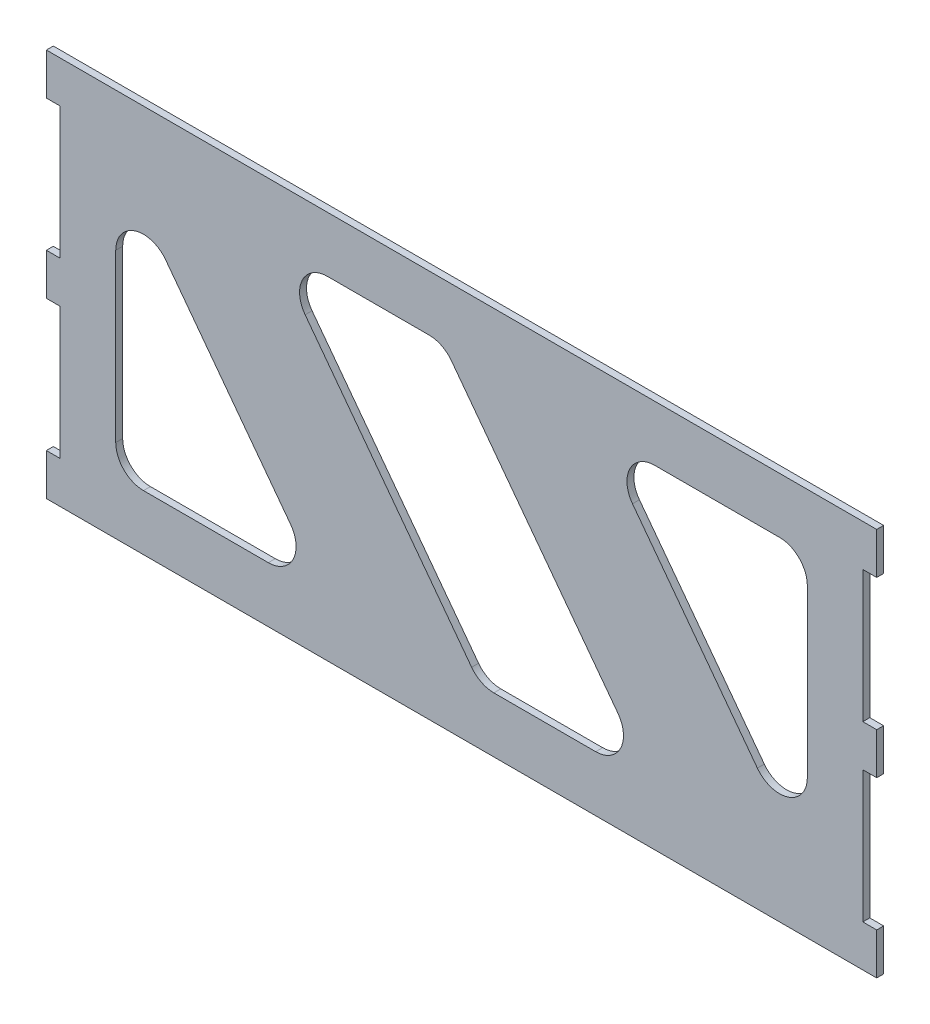
from build123d import *

# Parameters (mm, degrees)
SKETCH1_W           = 183.656
SKETCH1_H           = 88.9
BOSS_EXTRUDE1_DEPTH = 1.5875
CUT_EXTRUDE1_DEPTH  = 1.5875
FILLET1_R           = 6.35
SKETCH3_W           = 1.5875
SKETCH3_H           = 9.525
BOSS_EXTRUDE2_DEPTH = 3.175


with BuildPart() as part:
    # Sketch1 → Boss-Extrude1 (new body)
    with BuildSketch(Plane.XY):
        with Locations((3.944, 974.412014871)):
            Rectangle(SKETCH1_W, SKETCH1_H)
    extrude(amount=BOSS_EXTRUDE1_DEPTH)

    # Sketch2 → Cut-Extrude1 (cut)
    with BuildSketch(Plane.XY.offset(1.5875)):
        with BuildLine():
            Line((-63.754, 990.922014871), (-35.179, 952.822014871))
            ThreePointArc((-35.179, 952.822014871), (-34.579387337, 946.172208539), (-40.259, 942.662014871))
            Line((-40.259, 942.662014871), (-68.834, 942.662014871))
            ThreePointArc((-68.834, 942.662014871), (-73.324128061, 944.52188681), (-75.184, 949.012014871))
            Line((-75.184, 949.012014871), (-75.184, 987.112014871))
            ThreePointArc((-75.184, 987.112014871), (-70.842046314, 993.136153813), (-63.754, 990.922014871))
        make_face()
        with BuildLine():
            Line((71.642, 957.902014871), (43.067, 996.002014871))
            ThreePointArc((43.067, 996.002014871), (42.467387337, 1002.651821202), (48.147, 1006.162014871))
            Line((48.147, 1006.162014871), (76.722, 1006.162014871))
            ThreePointArc((76.722, 1006.162014871), (81.212128061, 1004.302142931), (83.072, 999.812014871))
            Line((83.072, 999.812014871), (83.072, 961.712014871))
            ThreePointArc((83.072, 961.712014871), (78.730046314, 955.687875928), (71.642, 957.902014871))
        make_face()
        Polygon((-39.46525, 1006.162014871), (8.15975, 942.662014871), (47.35325, 942.662014871), (-0.27175, 1006.162014871), align=None)
    extrude(amount=-CUT_EXTRUDE1_DEPTH, mode=Mode.SUBTRACT)

    # Fillet1
    fillet1_edges = [part.edges().sort_by_distance(p)[0] for p in [
        (8.15975, 942.662014871, 0.79375),
        (-39.46525, 1006.162014871, 0.79375),
        (-0.27175, 1006.162014871, 0.79375),
        (47.35325, 942.662014871, 0.79375),
    ]]
    fillet(fillet1_edges, radius=FILLET1_R)

    # Sketch3 → Boss-Extrude2 (add)
    with BuildSketch(Plane(origin=(95.772, 0, 0), x_dir=(0, 0, -1), z_dir=(1, 0, 0))):
        with Locations((-0.79375, 1014.099514871)):
            Rectangle(SKETCH3_W, SKETCH3_H)
        with Locations((-0.79375, 934.724514871)):
            Rectangle(SKETCH3_W, SKETCH3_H)
        with Locations((-0.79375, 974.412014871)):
            Rectangle(SKETCH3_W, SKETCH3_H)
    boss_extrude2 = extrude(amount=BOSS_EXTRUDE2_DEPTH)

    # Mirror2: Boss-Extrude2 across plane
    add(boss_extrude2.mirror(Plane(origin=(3.944, 0, 0), x_dir=(0, 0, 1), z_dir=(1, 0, 0))))


solid = part.part
